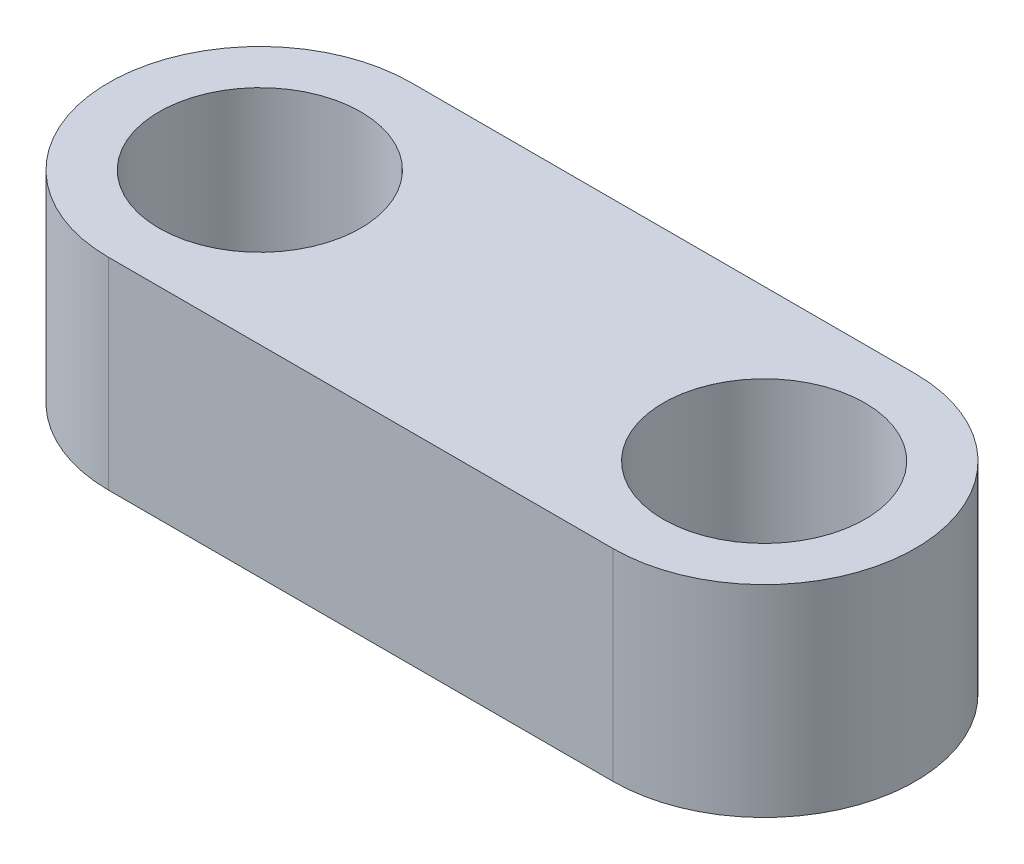
from build123d import *

# Parameters (mm, degrees)
SKETCH1_R           = 5
BOSS_EXTRUDE1_DEPTH = 10


with BuildPart() as part:
    # Sketch1 → Boss-Extrude1 (new body)
    with BuildSketch(Plane(origin=(0, 0, 0), x_dir=(1, 0, 0), z_dir=(0, 1, 0))):
        with BuildLine():
            Line((0, 0), (25, 0))
            ThreePointArc((25, 0), (32.5, 7.5), (25, 15))
            Line((25, 15), (0, 15))
            ThreePointArc((0, 15), (-7.5, 7.5), (0, 0))
        make_face()
        with Locations(Location((0, 7.5, 0), (0, 0, 270))):
            Circle(SKETCH1_R, mode=Mode.SUBTRACT)
        with Locations(Location((25, 7.5, 0), (0, 0, 270))):
            Circle(SKETCH1_R, mode=Mode.SUBTRACT)
    extrude(amount=BOSS_EXTRUDE1_DEPTH)


solid = part.part
